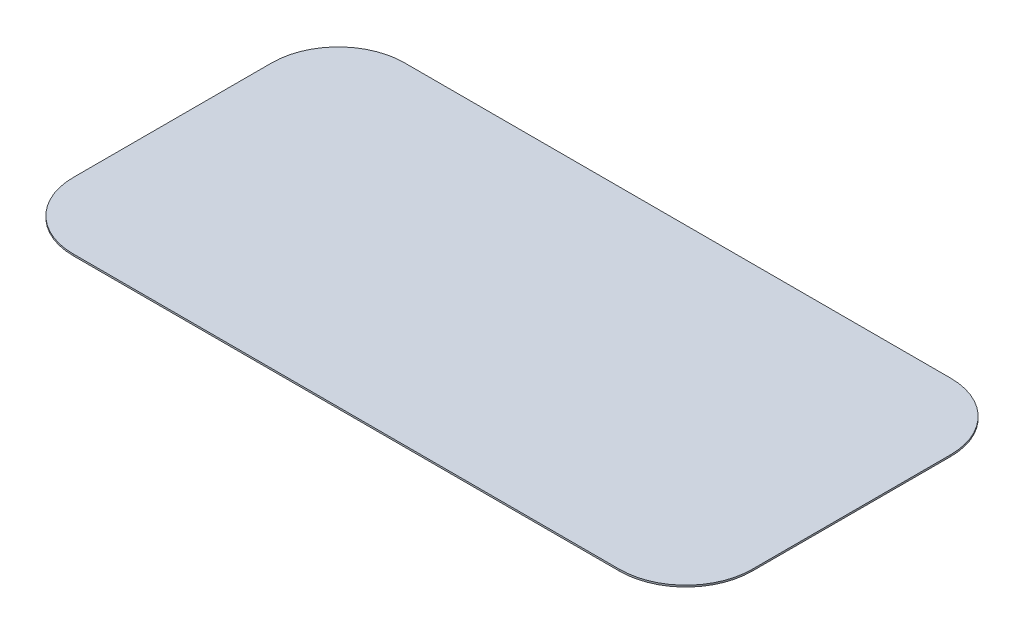
from build123d import *

# Parameters (mm, degrees)
ESQUISSE1_W        = 20.5
ESQUISSE1_H        = 10
BOSS_EXTRU_1_DEPTH = 0.05
CONG_1_R           = 2


with BuildPart() as part:
    # Esquisse1 → Boss.-Extru.1 (new body)
    with BuildSketch(Plane(origin=(0, 0, 0), x_dir=(1, 0, 0), z_dir=(0, 1, 0))):
        with Locations((10.25, 5)):
            Rectangle(ESQUISSE1_W, ESQUISSE1_H)
    extrude(amount=BOSS_EXTRU_1_DEPTH)

    # Congé1
    cong_1_edges = [part.edges().sort_by_distance(p)[0] for p in [
        (0, 0.025, -10),
        (20.5, 0.025, -10),
        (20.5, 0.025, 0),
        (0, 0.025, 0),
    ]]
    fillet(cong_1_edges, radius=CONG_1_R)


solid = part.part
